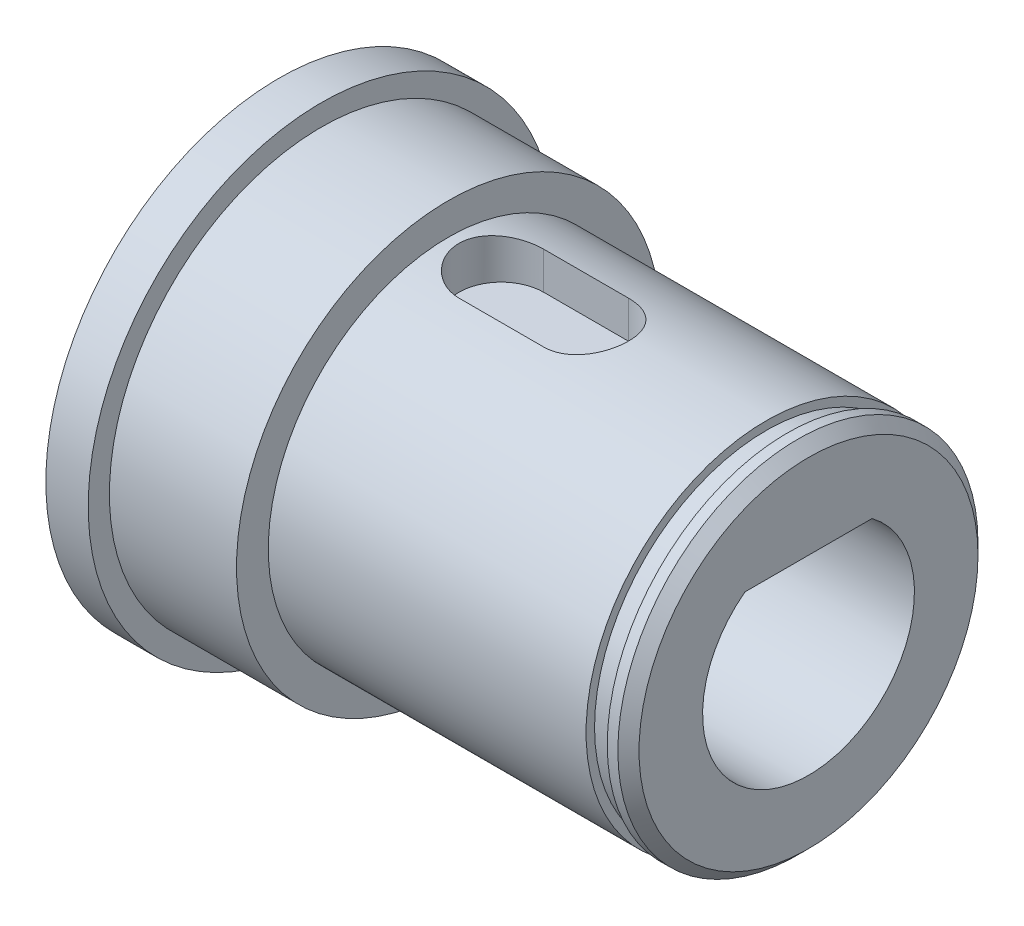
from build123d import *

# Parameters (mm, degrees)
SKETCH_1_R          = 11
EXTRUDE_1_DEPTH     = 2
SKETCH_2_R          = 10
EXTRUDE_2_DEPTH     = 6
SKETCH_3_R          = 8.5
EXTRUDE_3_DEPTH     = 17
CUT_EXTRUDE_1_DEPTH = 2
CUT_EXTRUDE_2_DEPTH = 30.444863729
SKETCH_6_W          = 1
SKETCH_6_H          = 0.8
CHAMFER_1_SIZE      = 0.5
SKETCH_8_R          = 7.5
CUT_EXTRUDE_4_DEPTH = 5


with BuildPart() as part:
    # 草图1 → 凸台-拉伸1 (new body)
    with BuildSketch(Plane(origin=(0, 0, 0), x_dir=(0, 0, -1), z_dir=(1, 0, 0))):
        Circle(SKETCH_1_R)
    extrude(amount=EXTRUDE_1_DEPTH)

    # 草图2 → 凸台-拉伸2 (add)
    with BuildSketch(Plane(origin=(2, 0, 0), x_dir=(0, 0, -1), z_dir=(1, 0, 0))):
        Circle(SKETCH_2_R)
    extrude(amount=EXTRUDE_2_DEPTH)

    # 草图3 → 凸台-拉伸3 (add)
    with BuildSketch(Plane(origin=(8, 0, 0), x_dir=(0, 0, -1), z_dir=(1, 0, 0))):
        Circle(SKETCH_3_R)
    extrude(amount=EXTRUDE_3_DEPTH)

    # 草图4 → 切除-拉伸1 (cut)
    with BuildSketch(Plane(origin=(0, 8.5, 0), x_dir=(1, 0, 0), z_dir=(0, 1, 0))):
        with BuildLine():
            Line((10.5, 2), (14.5, 2))
            ThreePointArc((14.5, 2), (16.5, 0), (14.5, -2))
            Line((14.5, -2), (10.5, -2))
            ThreePointArc((10.5, -2), (8.5, 0), (10.5, 2))
        make_face()
    extrude(amount=-CUT_EXTRUDE_1_DEPTH, mode=Mode.SUBTRACT)

    # 草图5 → 切除-拉伸2 (cut, through all)
    with BuildSketch(Plane(origin=(25, 0, 0), x_dir=(0, 0, -1), z_dir=(1, 0, 0))):
        with BuildLine():
            Line((-3, 4), (3, 4))
            ThreePointArc((3, 4), (0, -5), (-3, 4))
        make_face()
    extrude(amount=-CUT_EXTRUDE_2_DEPTH, mode=Mode.SUBTRACT)

    # 草图6 → 切除-旋转1 (revolve, cut)
    with BuildSketch(Plane.XY):
        with Locations((23.5, 8.5)):
            Rectangle(SKETCH_6_W, SKETCH_6_H)
    revolve(axis=Axis((0, 0, 0), (1, 0, 0)), mode=Mode.SUBTRACT)

    # 倒角1
    chamfer_1_edges = [part.edges().sort_by_distance(p)[0] for p in [
        (25, 0, 8.5),
    ]]
    chamfer(chamfer_1_edges, length=CHAMFER_1_SIZE)

    # 草图8 → 切除-拉伸4 (cut)
    with BuildSketch(Plane.ZY):
        Circle(SKETCH_8_R)
    extrude(amount=-CUT_EXTRUDE_4_DEPTH, mode=Mode.SUBTRACT)


solid = part.part
